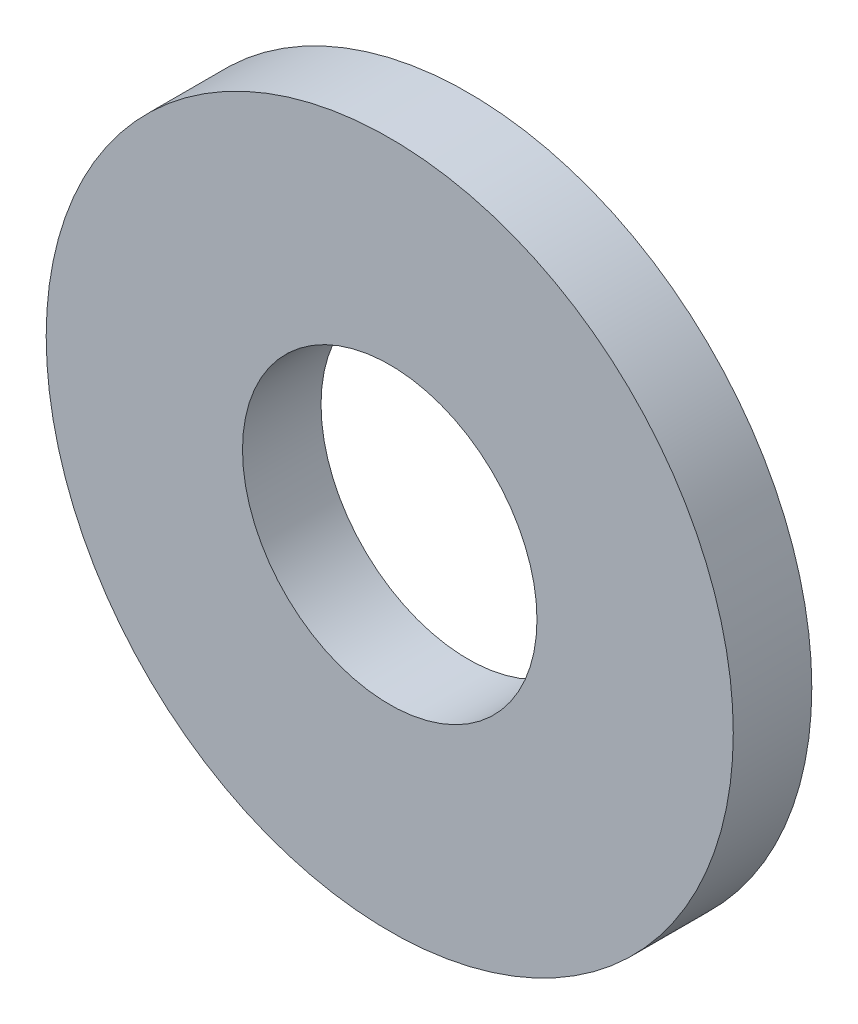
from build123d import *

# Parameters (mm, degrees)
SKETCH2_R           = 11.1125
SKETCH2_R_2         = 4.7625
BOSS_EXTRUDE1_DEPTH = 1.27


with BuildPart() as part:
    # Sketch2 → Boss-Extrude1 (new, symmetric)
    with BuildSketch(Plane.XY):
        Circle(SKETCH2_R)
        Circle(SKETCH2_R_2, mode=Mode.SUBTRACT)
    extrude(amount=BOSS_EXTRUDE1_DEPTH, both=True)


solid = part.part
